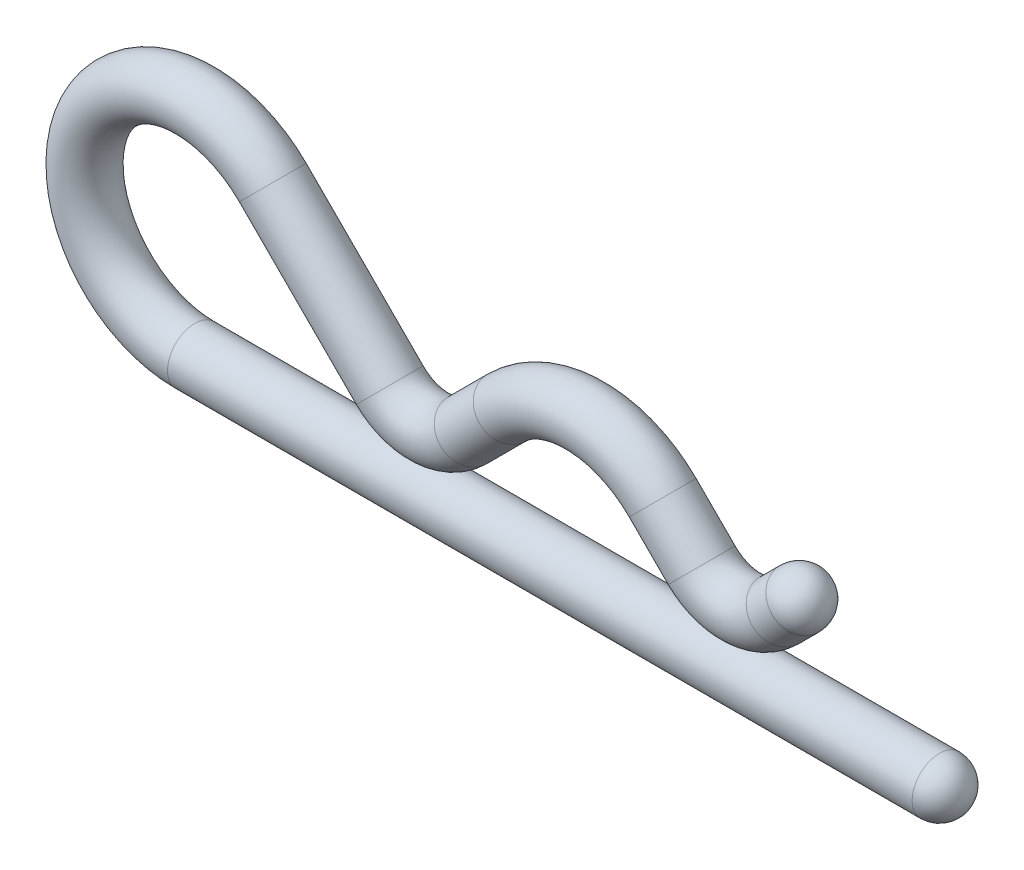
from build123d import *

# Parameters (mm, degrees)
SKETCH2_R = 0.99
FILLET1_R = 0.99


with BuildPart() as part:
    # Sweep3: sweep along a path in Sketch1
    with BuildLine(Plane.XY) as sweep3_path:
        Line((0, 0), (-28, 0))
        ThreePointArc((-28, 0), (-31.69551813, 5.530733729), (-25.171572875, 6.828427125))
        Line((-25.171572875, 6.828427125), (-20.928932188, 2.585786438))
        ThreePointArc((-20.928932188, 2.585786438), (-19.514718626, 2), (-18.100505063, 2.585786438))
        Line((-18.100505063, 2.585786438), (-16.686291501, 4))
        ThreePointArc((-16.686291501, 4), (-13.857864376, 5.171572875), (-11.029437252, 4))
        Line((-11.029437252, 4), (-9.615223689, 2.585786438))
        ThreePointArc((-9.615223689, 2.585786438), (-8.201010127, 2), (-6.786796564, 2.585786438))
        Line((-6.786796564, 2.585786438), (-5.372583002, 4))
    # Sketch2 → Sweep3 (sweep)
    with BuildSketch(Plane(origin=(0, 0, 0), x_dir=(0, 0, -1), z_dir=(1, 0, 0))):
        Circle(SKETCH2_R)
    sweep(path=sweep3_path.line)

    # Fillet1
    fillet1_edges = [part.edges().sort_by_distance(p)[0] for p in [
        (-5.372583002, 4, 0.99),
        (0, 0, 0.99),
    ]]
    fillet(fillet1_edges, radius=FILLET1_R)


solid = part.part
